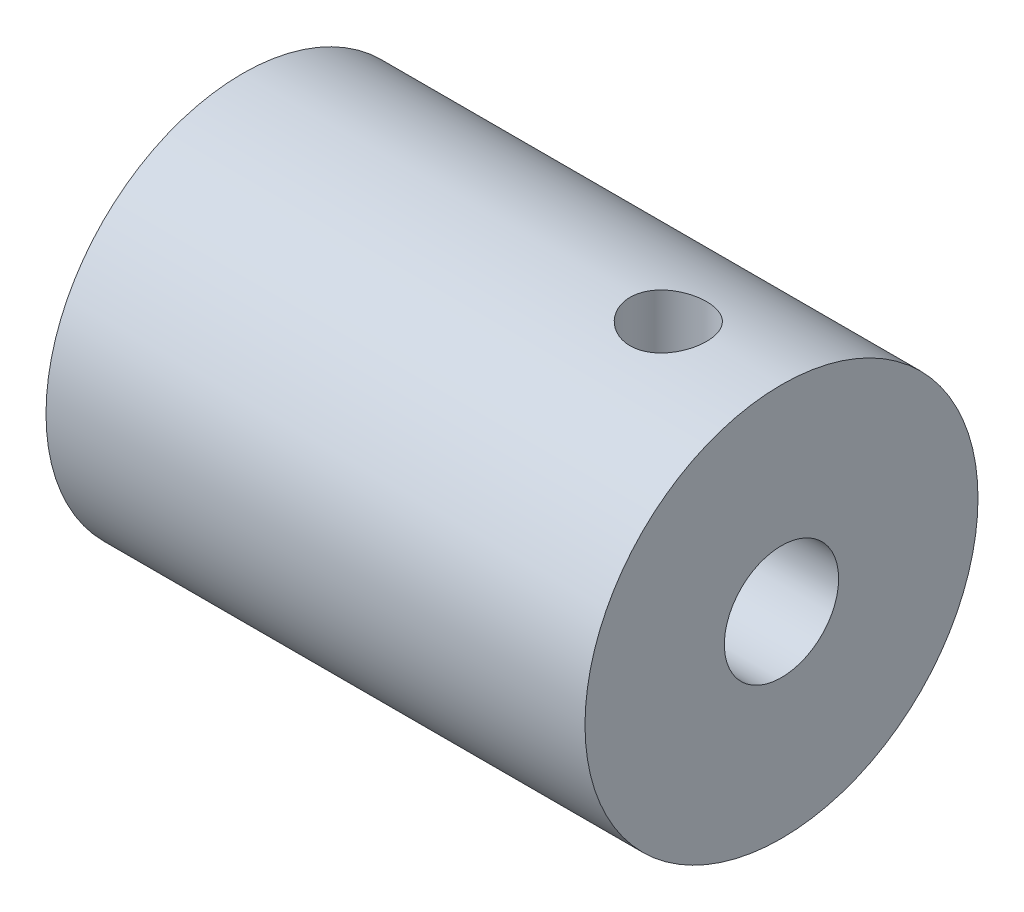
from build123d import *

# Parameters (mm, degrees)
SKETCH1_R                       = 6.9453125
BOSS_EXTRUDE1_DEPTH             = 19.05
F_21_0_159_DIAMETER_HOLE1_D     = 4.0386
F_21_0_159_DIAMETER_HOLE1_DEPTH = 7.0000114
F_21_0_159_DIAMETER_HOLE1_TIP   = 1.213317848
SKETCH5_W                       = 1.35255
SKETCH5_H                       = 6.9453125


with BuildPart() as part:
    # Sketch1 → Boss-Extrude1 (new body)
    with BuildSketch(Plane(origin=(0, 0, 0), x_dir=(0, 0, -1), z_dir=(1, 0, 0))):
        with Locations(Location((0, 0, 0), (0, 0, 180))):
            Circle(SKETCH1_R)
    extrude(amount=BOSS_EXTRUDE1_DEPTH)

    # #21 (0.159) Diameter Hole1
    with Locations(Plane(origin=(19.05, 0, 0), x_dir=(0, 0, -1), z_dir=(1, 0, 0))):
        with Locations((0, 0)):
            Hole(F_21_0_159_DIAMETER_HOLE1_D / 2, depth=F_21_0_159_DIAMETER_HOLE1_DEPTH)
            with Locations((0, 0, -(F_21_0_159_DIAMETER_HOLE1_DEPTH + F_21_0_159_DIAMETER_HOLE1_TIP / 2))):  # 118° drill point
                Cone(0, F_21_0_159_DIAMETER_HOLE1_D / 2, F_21_0_159_DIAMETER_HOLE1_TIP, mode=Mode.SUBTRACT)

    # Sketch5 → #6-32 Tapped Hole1 (revolve, cut)
    with BuildSketch(Plane(origin=(15.05, 0, 0), x_dir=(0, 0, -1), z_dir=(1, 0, 0))):
        with Locations((0.676275, 3.47265625)):
            Rectangle(SKETCH5_W, SKETCH5_H)
    revolve(axis=Axis((15.05, -6.35, 0), (0, 1, 0)), mode=Mode.SUBTRACT)


solid = part.part
